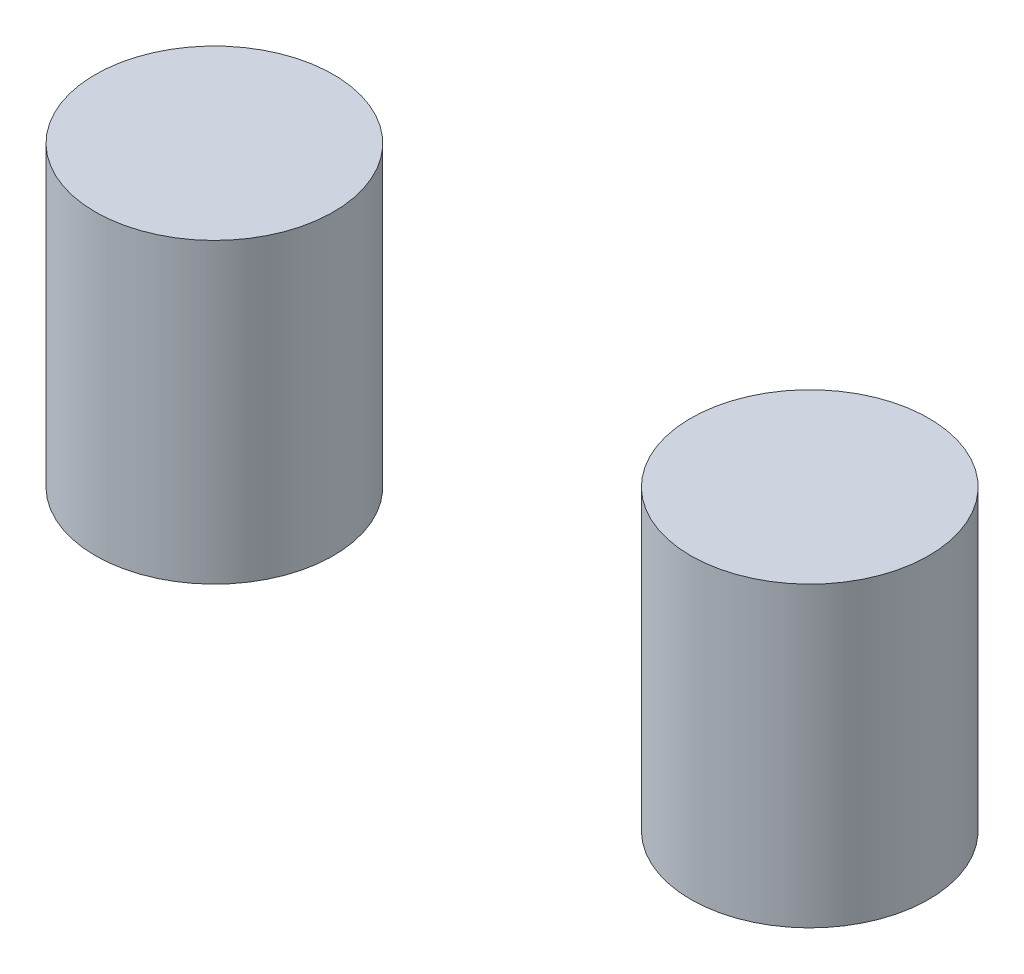
from build123d import *

# Parameters (mm, degrees)
SKETCH1_R             = 4
BOSS_EXTRUDE1_DEPTH   = 10
BOSS_EXTRUDE1_2_DEPTH = 10


with BuildPart() as part:
    # Sketch1 → Boss-Extrude1 (new body)
    with BuildSketch(Plane(origin=(0, 0, 0), x_dir=(1, 0, 0), z_dir=(0, 1, 0))):
        with Locations(Location((10, 0, 0), (0, 0, 270))):
            Circle(SKETCH1_R)
    extrude(amount=BOSS_EXTRUDE1_DEPTH)


with BuildPart() as body_2:
    # Sketch1 → Boss-Extrude1 2 (new body)
    with BuildSketch(Plane(origin=(0, 0, 0), x_dir=(1, 0, 0), z_dir=(0, 1, 0))):
        with Locations(Location((-10, 0, 0), (0, 0, 270))):
            Circle(SKETCH1_R)
    extrude(amount=BOSS_EXTRUDE1_2_DEPTH)


solid = Compound([part.part, body_2.part])
